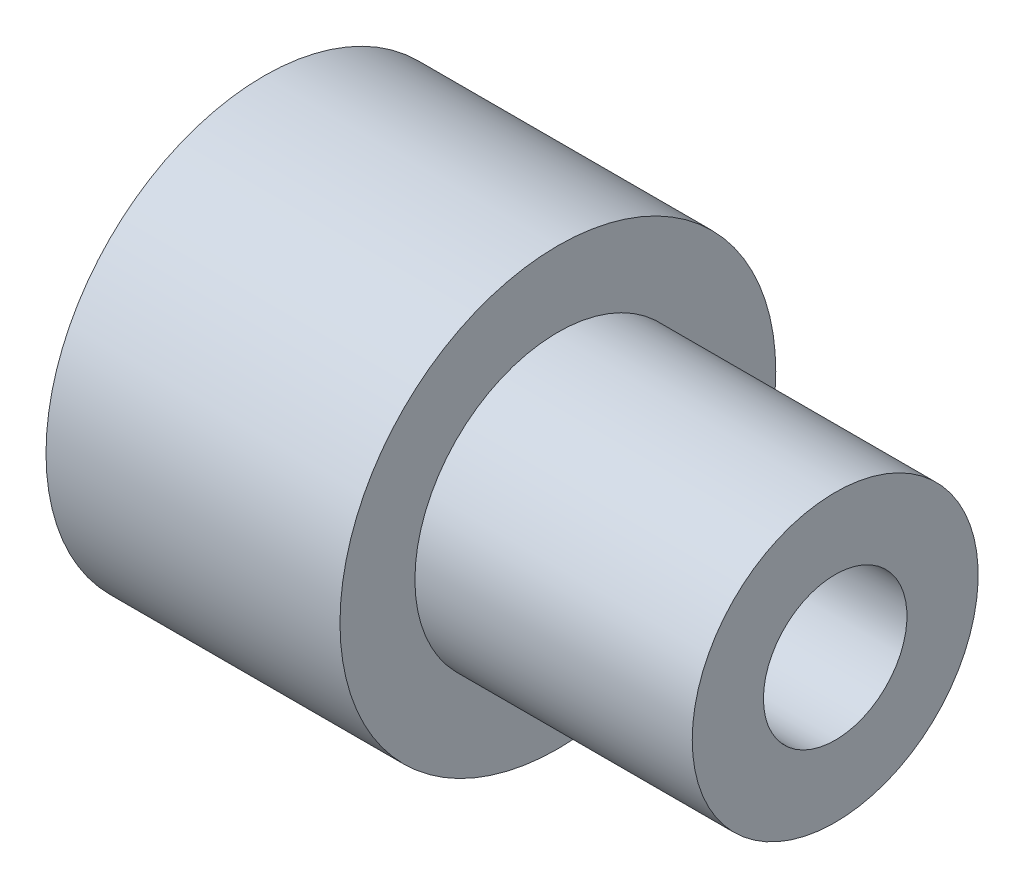
from build123d import *

# Parameters (mm, degrees)
FORO_FILETTATO_M3X0_5_1_D = 2.5


with BuildPart() as part:
    # Schizzo1 → Rivoluzione1 (revolve)
    with BuildSketch(Plane.XY, mode=Mode.PRIVATE) as rivoluzione1_sk:
        Polygon((0, 0), (0, 3.795), (5.12, 3.795), (5.12, 2.49), (9.95, 2.49), (9.95, 0), align=None)
    revolve(rivoluzione1_sk.sketch.rotate(Axis((0, 0, 0), (1, 0, 0)), 90), axis=Axis((0, 0, 0), (1, 0, 0)))

    # Foro filettato M3x0.5-1 (through all)
    with Locations(Plane.ZY):
        with Locations((0, 0)):
            Hole(FORO_FILETTATO_M3X0_5_1_D / 2)


solid = part.part
